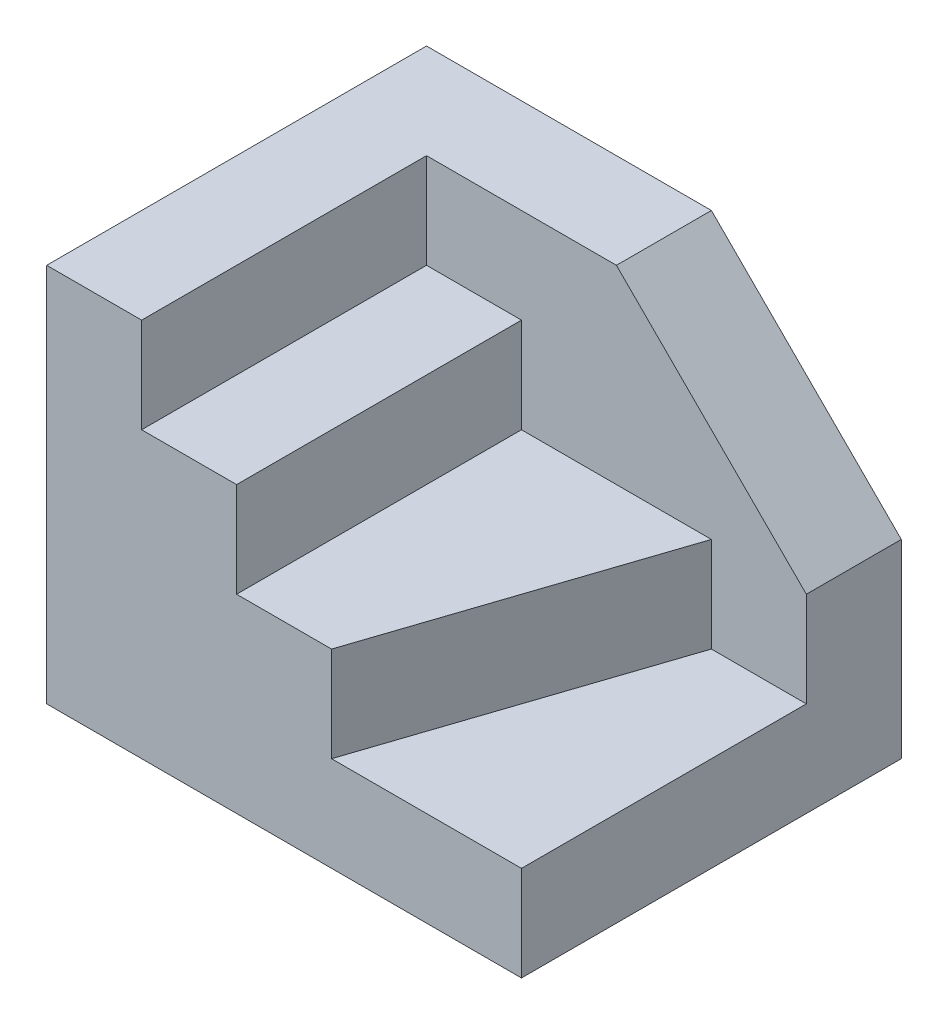
from build123d import *

# Parameters (mm, degrees)
SKETCH_1_W      = 5
SKETCH_1_H      = 4
EXTRUDE_1_DEPTH = 1
EXTRUDE_2_DEPTH = 1
EXTRUDE_3_DEPTH = 3
EXTRUDE_4_DEPTH = 1


with BuildPart() as part:
    # 草圖1 → 填料-伸長1 (new body)
    with BuildSketch(Plane(origin=(0, 0, 0), x_dir=(1, 0, 0), z_dir=(0, 1, 0))):
        with Locations((2.5, 2)):
            Rectangle(SKETCH_1_W, SKETCH_1_H)
    extrude(amount=EXTRUDE_1_DEPTH)

    # 草圖2 → 填料-伸長2 (add)
    with BuildSketch(Plane(origin=(0, 0, -4), x_dir=(-1, 0, 0), z_dir=(0, 0, -1))):
        Polygon((0, 1), (0, 4), (-3, 4), (-5, 2), (-5, 1), align=None)
    extrude(amount=-EXTRUDE_2_DEPTH)

    # 草圖3 → 填料-伸長3 (add)
    with BuildSketch(Plane.XY):
        Polygon((0, 1), (0, 4), (1, 4), (1, 3), (2, 3), (2, 2), (3, 2), (3, 1), align=None)
    extrude(amount=-EXTRUDE_3_DEPTH)

    # 草圖4 → 填料-伸長4 (add)
    with BuildSketch(Plane(origin=(0, 1, 0), x_dir=(1, 0, 0), z_dir=(0, 1, 0))):
        Polygon((3, 0), (3, 3), (4, 3), align=None)
    extrude(amount=EXTRUDE_4_DEPTH)


solid = part.part
